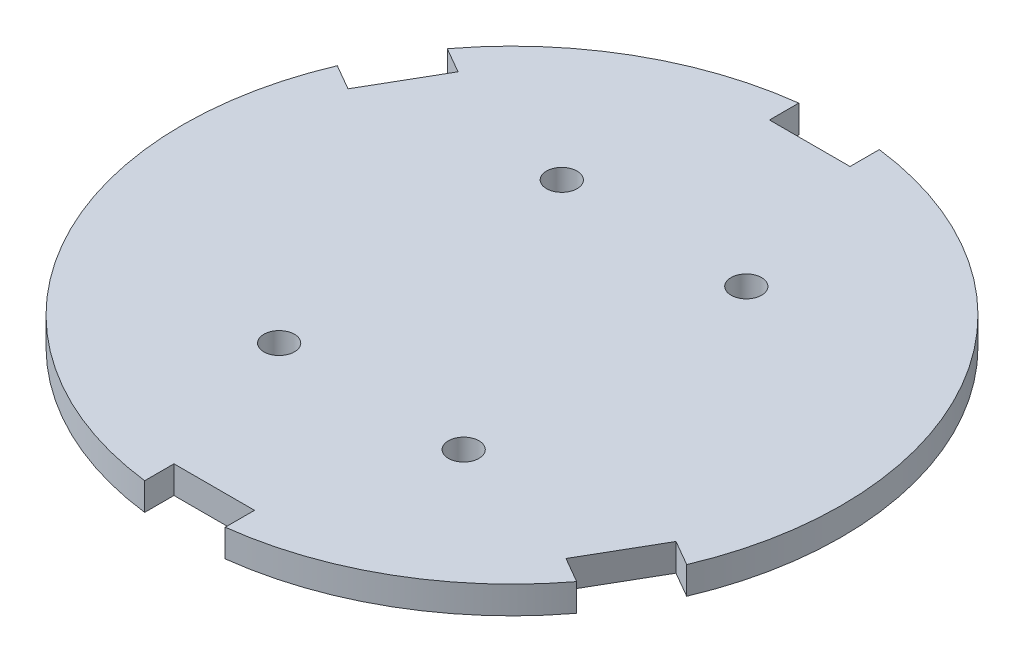
from build123d import *

# Parameters (mm, degrees)
SKETCH1_R                  = 57.15
BOSS_EXTRUDE1_DEPTH        = 4.7625
CUT_EXTRUDE1_REACH         = 82.963
CUT_EXTRUDE2_REACH         = 82.661
F_4_0_209_DIAMETER_HOLE1_D = 5.3086


with BuildPart() as part:
    # Sketch1 → Boss-Extrude1 (new body)
    with BuildSketch(Plane(origin=(0, 0, 0), x_dir=(1, 0, 0), z_dir=(0, 1, 0))):
        with Locations(Location((0, 0, 0), (0, 0, 90))):
            Circle(SKETCH1_R)
    extrude(amount=BOSS_EXTRUDE1_DEPTH)

    # Sketch2 → Cut-Extrude1 (cut, up to next)
    with BuildSketch(Plane(origin=(0, 4.7625, 0), x_dir=(1, 0, 0), z_dir=(0, 1, 0)), mode=Mode.PRIVATE) as cut_extrude1_sk1:
        with BuildLine():
            Line((-6.985, -51.641532728), (6.985, -51.641532728))
            Line((6.985, -51.641532728), (6.985, -56.721532728))
            ThreePointArc((6.985, -56.721532728), (0, -57.15), (-6.985, -56.721532728))
            Line((-6.985, -56.721532728), (-6.985, -51.641532728))
        make_face()
    cut_extrude1_tool1 = extrude(cut_extrude1_sk1.sketch, amount=-CUT_EXTRUDE1_REACH, mode=Mode.PRIVATE) & part.part
    # Sketch2 → Cut-Extrude1 (cut, up to next)
    with BuildSketch(Plane(origin=(0, 4.7625, 0), x_dir=(1, 0, 0), z_dir=(0, 1, 0)), mode=Mode.PRIVATE) as cut_extrude1_sk2:
        with BuildLine():
            Line((-6.985, 51.641532728), (-6.985, 56.721532728))
            ThreePointArc((-6.985, 56.721532728), (0, 57.15), (6.985, 56.721532728))
            Line((6.985, 56.721532728), (6.985, 51.641532728))
            Line((6.985, 51.641532728), (-6.985, 51.641532728))
        make_face()
    cut_extrude1_tool2 = extrude(cut_extrude1_sk2.sketch, amount=-CUT_EXTRUDE1_REACH, mode=Mode.PRIVATE) & part.part
    add(cut_extrude1_tool1.solids().sort_by_distance((0, 4.7625, 54.325982))[0], mode=Mode.SUBTRACT)
    add(cut_extrude1_tool2.solids().sort_by_distance((0, 4.7625, -54.325982))[0], mode=Mode.SUBTRACT)

    # Sketch3 → Cut-Extrude2 (cut, up to next)
    with BuildSketch(Plane(origin=(0, 4.7625, 0), x_dir=(1, 0, 0), z_dir=(0, 1, 0)), mode=Mode.PRIVATE) as cut_extrude2_sk1:
        with BuildLine():
            Line((41.230379233, -31.869953809), (48.215379233, -19.771578919))
            Line((48.215379233, -19.771578919), (52.614788284, -22.311578919))
            ThreePointArc((52.614788284, -22.311578919), (49.493351826, -28.575), (45.629788284, -34.409953809))
            Line((45.629788284, -34.409953809), (41.230379233, -31.869953809))
        make_face()
    cut_extrude2_tool1 = extrude(cut_extrude2_sk1.sketch, amount=-CUT_EXTRUDE2_REACH, mode=Mode.PRIVATE) & part.part
    # Sketch3 → Cut-Extrude2 (cut, up to next)
    with BuildSketch(Plane(origin=(0, 4.7625, 0), x_dir=(1, 0, 0), z_dir=(0, 1, 0)), mode=Mode.PRIVATE) as cut_extrude2_sk2:
        with BuildLine():
            Line((-41.230379233, 31.869953809), (-45.629788284, 34.409953809))
            ThreePointArc((-45.629788284, 34.409953809), (-49.493351826, 28.575), (-52.614788284, 22.311578919))
            Line((-52.614788284, 22.311578919), (-48.215379233, 19.771578919))
            Line((-48.215379233, 19.771578919), (-41.230379233, 31.869953809))
        make_face()
    cut_extrude2_tool2 = extrude(cut_extrude2_sk2.sketch, amount=-CUT_EXTRUDE2_REACH, mode=Mode.PRIVATE) & part.part
    add(cut_extrude2_tool1.solids().sort_by_distance((47.04768, 4.7625, 27.162991))[0], mode=Mode.SUBTRACT)
    add(cut_extrude2_tool2.solids().sort_by_distance((-47.04768, 4.7625, -27.162991))[0], mode=Mode.SUBTRACT)

    # #4 (0.209) Diameter Hole1 (through all)
    with Locations(Plane(origin=(16.002, 4.7625, -24.638), x_dir=(0, 0, 1), z_dir=(0, 1, 0))):
        with Locations((0, 0), (49.022, 0), (49.022, -32.004), (0, -32.004)):
            Hole(F_4_0_209_DIAMETER_HOLE1_D / 2)


solid = part.part
